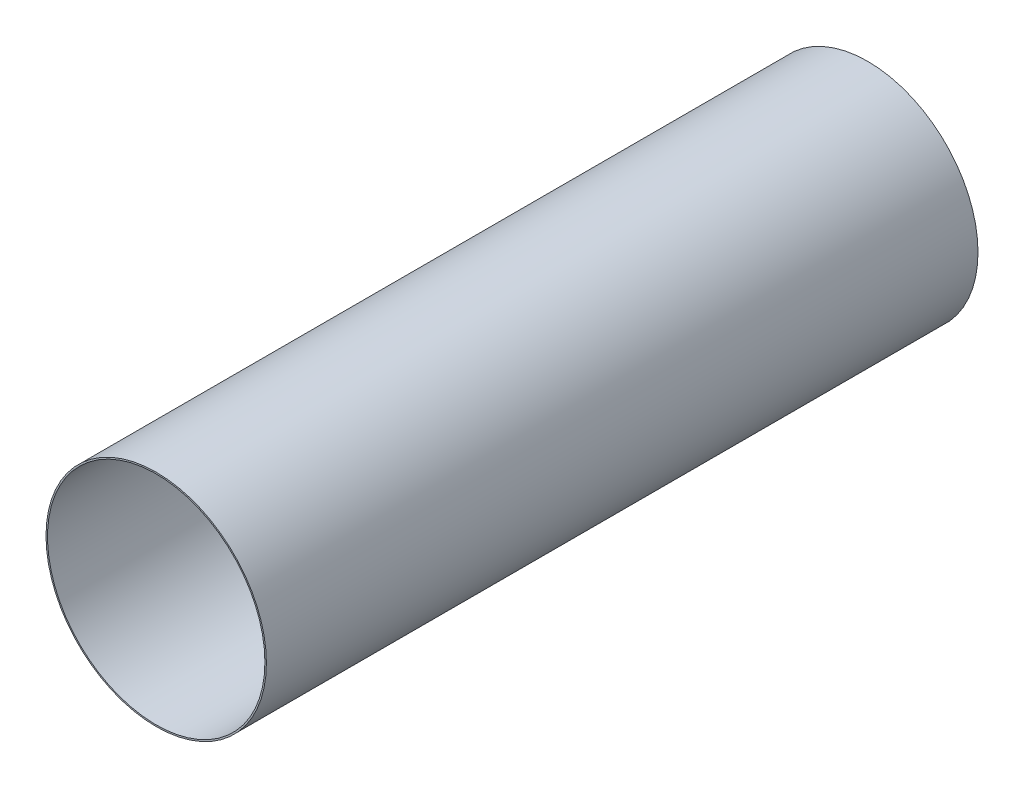
from build123d import *

# Parameters (mm, degrees)
SKETCH1_R      = 70.8025
SKETCH1_R_2    = 69.85
EXTRUDE1_DEPTH = 457.2


with BuildPart() as part:
    # Sketch1 → Extrude1 (new body)
    with BuildSketch(Plane.XY):
        Circle(SKETCH1_R)
        Circle(SKETCH1_R_2, mode=Mode.SUBTRACT)
    extrude(amount=EXTRUDE1_DEPTH)


solid = part.part
